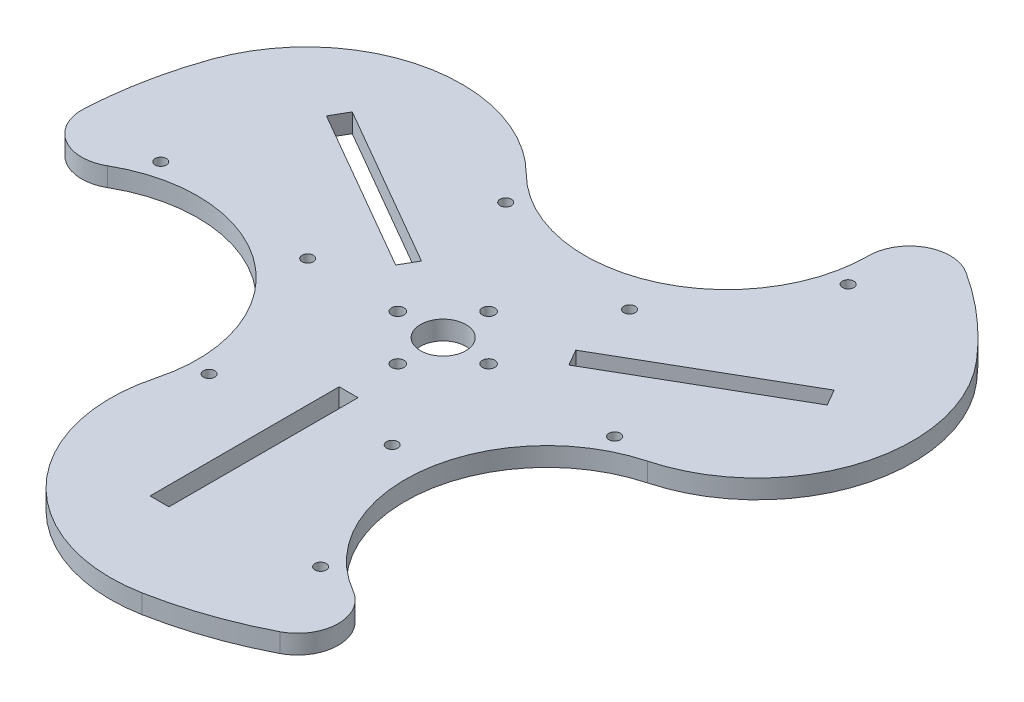
from build123d import *

# Parameters (mm, degrees)
SKETCH_1_R               = 6
EXTRUDE_1_DEPTH          = 5
CUT_EXTRUDE_1_DEPTH      = 142.435598161
CUT_EXTRUDE_1_DEPTH_BACK = 142.435598161
SKETCH_5_W               = 5
SKETCH_5_H               = 50
F_3_0MM_1_D              = 3
PATTERN_CIRCULAR_1_COUNT = 3
HOLE_WIZARD_M4_1_D       = 3.3


with BuildPart() as part:
    # 草圖1 → 填料-伸長1 (new body)
    with BuildSketch(Plane(origin=(0, 0, 0), x_dir=(1, 0, 0), z_dir=(0, 1, 0))):
        with BuildLine():
            ThreePointArc((-54.140127389, 84.076433121), (-86.602540378, 50), (-99.882390637, 4.848509122))
            ThreePointArc((-99.882390637, 4.848509122), (-94.722486108, -4.890404948), (-83.701905284, -5.024047358))
            ThreePointArc((-83.701905284, -5.024047358), (-32.475952642, -18.75), (-46.201905284, -69.975952642))
            ThreePointArc((-46.201905284, -69.975952642), (-51.596457973, -79.586876805), (-45.742263248, -88.924942243))
            ThreePointArc((-45.742263248, -88.924942243), (0, -100), (45.742263248, -88.924942243))
            ThreePointArc((45.742263248, -88.924942243), (51.596457973, -79.586876805), (46.201905284, -69.975952642))
            ThreePointArc((46.201905284, -69.975952642), (32.475952642, -18.75), (83.701905284, -5.024047358))
            ThreePointArc((83.701905284, -5.024047358), (94.722486108, -4.890404948), (99.882390637, 4.848509122))
            ThreePointArc((99.882390637, 4.848509122), (86.602540378, 50), (54.140127389, 84.076433121))
            ThreePointArc((54.140127389, 84.076433121), (43.126028135, 84.477281753), (37.5, 75))
            ThreePointArc((37.5, 75), (0, 37.5), (-37.5, 75))
            ThreePointArc((-37.5, 75), (-43.126028135, 84.477281753), (-54.140127389, 84.076433121))
        make_face()
        with Locations(Location((0, 0, 0), (0, 0, 270))):
            Circle(SKETCH_1_R, mode=Mode.SUBTRACT)
    extrude(amount=-EXTRUDE_1_DEPTH)

    # 草圖5 → 除料-伸長1 (cut, two sides: drawn at the far end of the back side and taken through both)
    with BuildSketch(Plane(origin=(0, 0, 0), x_dir=(1, 0, 0), z_dir=(0, 1, 0)).offset(-CUT_EXTRUDE_1_DEPTH_BACK)):
        with BuildLine():
            ThreePointArc((18.659757868, -98.243643236), (-14.320442433, -98.969313065), (-45.742263248, -88.924942243))
            ThreePointArc((-45.742263248, -88.924942243), (-51.596457973, -79.586876805), (-46.201905284, -69.975952642))
            ThreePointArc((-46.201905284, -69.975952642), (-35.201155023, -60.328553588), (-28.729686798, -47.205714191))
            ThreePointArc((-28.729686798, -47.205714191), (-19.144613028, -85.825688538), (18.659757868, -98.243643236))
        make_face()
        with BuildLine():
            ThreePointArc((75.751611869, 65.28164596), (92.870160526, 37.082789592), (99.882390637, 4.848509122))
            ThreePointArc((99.882390637, 4.848509122), (94.722486108, -4.890404948), (83.701905284, -5.024047358))
            ThreePointArc((83.701905284, -5.024047358), (69.846637492, -0.320817698), (55.246191092, -1.277781514))
            ThreePointArc((55.246191092, -1.277781514), (83.899533086, 26.333123041), (75.751611869, 65.28164596))
        make_face()
        Polygon((-20.400635095, 14.665063509), (-22.900635095, 10.334936491), (-66.201905284, 35.334936491), (-63.701905284, 39.665063509), align=None)
        with Locations((0, -50)):
            Rectangle(SKETCH_5_W, SKETCH_5_H)
        Polygon((22.900635095, 10.334936491), (20.400635095, 14.665063509), (63.701905284, 39.665063509), (66.201905284, 35.334936491), align=None)
        with BuildLine():
            ThreePointArc((-37.5, 75), (-34.645482469, 60.649371286), (-26.516504294, 48.483495706))
            ThreePointArc((-26.516504294, 48.483495706), (-64.754920057, 59.492565497), (-94.411369737, 32.961997276))
            ThreePointArc((-94.411369737, 32.961997276), (-78.549718093, 61.886523473), (-54.140127389, 84.076433121))
            ThreePointArc((-54.140127389, 84.076433121), (-43.126028135, 84.477281753), (-37.5, 75))
        make_face()
    extrude(amount=CUT_EXTRUDE_1_DEPTH + CUT_EXTRUDE_1_DEPTH_BACK, mode=Mode.SUBTRACT)

    # Ø3.0mm 定位孔1 (through all)
    with Locations(Plane(origin=(0, 0, 0), x_dir=(1, 0, 0), z_dir=(0, 1, 0))):
        with Locations((-36.018712394, 0.206471091), (-22.625047496, -39.249993361), (-77.597265982, 2.931673472)):
            f_3_0mm_1 = Hole(F_3_0MM_1_D / 2)

    # 環狀複製排列1: Ø3.0mm 定位孔1 ×3 about axis
    pattern_circular_1_axis = Axis((0, 0, 0), (0, 1, 0))
    for i in range(1, PATTERN_CIRCULAR_1_COUNT):
        add(f_3_0mm_1.rotate(pattern_circular_1_axis, i * 360 / PATTERN_CIRCULAR_1_COUNT), mode=Mode.SUBTRACT)

    # M4 螺紋孔1 (through all)
    with Locations(Plane(origin=(0, 0, 0), x_dir=(1, 0, 0), z_dir=(0, 1, 0))):
        with Locations((0, 12), (12, 0), (0, -12), (-12, 0)):
            Hole(HOLE_WIZARD_M4_1_D / 2)


solid = part.part
